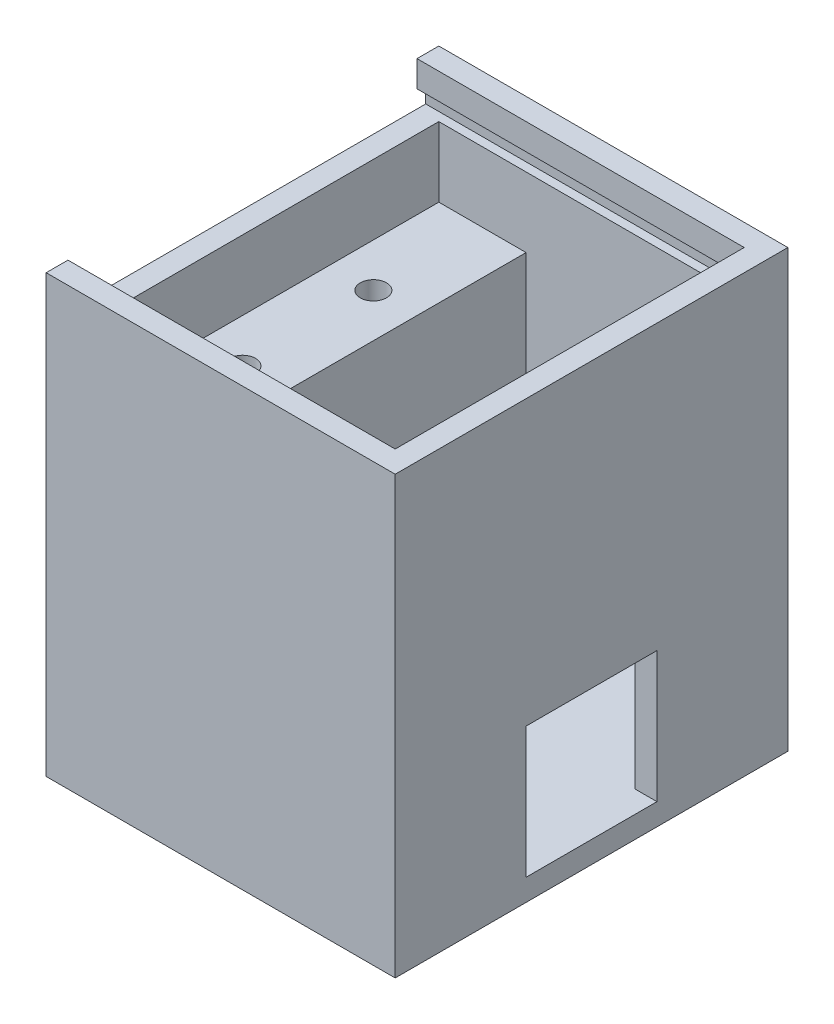
from build123d import *

# Parameters (mm, degrees)
SKETCH1_W           = 40
SKETCH1_H           = 45
BOSS_EXTRUDE1_DEPTH = 50
SHELL1_T            = -2.5
SKETCH3_W           = 40
SKETCH3_H           = 34.5
BOSS_EXTRUDE2_DEPTH = 10
SKETCH11_W          = 40
SKETCH11_H          = 5
CUT_EXTRUDE2_DEPTH  = 2.5
SKETCH12_W          = 37.5
SKETCH12_H          = 2
CUT_EXTRUDE3_DEPTH  = 1
SKETCH13_W          = 37.5
SKETCH13_H          = 2
CUT_EXTRUDE4_DEPTH  = 1
SKETCH15_R          = 1.5
CUT_EXTRUDE7_DEPTH  = 37
SKETCH16_R          = 1.5
CUT_EXTRUDE8_DEPTH  = 37
SKETCH17_R          = 3
CUT_EXTRUDE9_DEPTH  = 5
SKETCH19_W          = 15
SKETCH19_H          = 15
CUT_EXTRUDE10_DEPTH = 2.5


with BuildPart() as part:
    # Sketch1 → Boss-Extrude1 (new body)
    with BuildSketch(Plane(origin=(0, 0, 0), x_dir=(1, 0, 0), z_dir=(0, 1, 0))):
        with Locations((-14.888700463, -8.449653636)):
            Rectangle(SKETCH1_W, SKETCH1_H)
    extrude(amount=BOSS_EXTRUDE1_DEPTH)

    # Shell1
    shell1_openings = [part.faces().sort_by_distance(p)[0] for p in [
        (-14.888700463, 50, 8.449653636),
    ]]
    offset(amount=SHELL1_T, openings=shell1_openings, kind=Kind.INTERSECTION)

    # Sketch3 → Boss-Extrude2 (add)
    with BuildSketch(Plane(origin=(-32.388700463, 0, 0), x_dir=(0, 0, -1), z_dir=(1, 0, 0))):
        with Locations((-8.449653636, 19.75)):
            Rectangle(SKETCH3_W, SKETCH3_H)
    extrude(amount=BOSS_EXTRUDE2_DEPTH)

    # Sketch11 → Cut-Extrude2 (cut)
    with BuildSketch(Plane(origin=(-32.388700463, 0, 0), x_dir=(0, 0, -1), z_dir=(1, 0, 0))):
        with Locations((-8.449653636, 47.5)):
            Rectangle(SKETCH11_W, SKETCH11_H)
    extrude(amount=-CUT_EXTRUDE2_DEPTH, mode=Mode.SUBTRACT)

    # Sketch12 → Cut-Extrude3 (cut)
    with BuildSketch(Plane.XY.offset(-11.550346364)):
        with Locations((-16.138700463, 46)):
            Rectangle(SKETCH12_W, SKETCH12_H)
    extrude(amount=-CUT_EXTRUDE3_DEPTH, mode=Mode.SUBTRACT)

    # Sketch13 → Cut-Extrude4 (cut)
    with BuildSketch(Plane(origin=(0, 0, 28.449653636), x_dir=(-1, 0, 0), z_dir=(0, 0, -1))):
        with Locations((16.138700463, 46)):
            Rectangle(SKETCH13_W, SKETCH13_H)
    extrude(amount=-CUT_EXTRUDE4_DEPTH, mode=Mode.SUBTRACT)

    # Sketch15 → Cut-Extrude7 (cut)
    with BuildSketch(Plane(origin=(0, 37, 0), x_dir=(1, 0, 0), z_dir=(0, 1, 0))):
        with Locations(Location((-27.388700463, -15.949653636, 0), (0, 0, 270))):
            Circle(SKETCH15_R)
    extrude(amount=-CUT_EXTRUDE7_DEPTH, mode=Mode.SUBTRACT)

    # Sketch16 → Cut-Extrude8 (cut)
    with BuildSketch(Plane(origin=(0, 37, 0), x_dir=(1, 0, 0), z_dir=(0, 1, 0))):
        with Locations(Location((-27.388700463, -0.949653636, 0), (0, 0, 270))):
            Circle(SKETCH16_R)
    extrude(amount=-CUT_EXTRUDE8_DEPTH, mode=Mode.SUBTRACT)

    # Sketch17 → Cut-Extrude9 (cut)
    with BuildSketch(Plane.XZ):
        with Locations(Location((-27.388700463, 15.949653636, 0), (0, 0, 270))):
            Circle(SKETCH17_R)
        with Locations(Location((-27.388700463, 0.949653636, 0), (0, 0, 270))):
            Circle(SKETCH17_R)
    extrude(amount=-CUT_EXTRUDE9_DEPTH, mode=Mode.SUBTRACT)

    # Sketch19 → Cut-Extrude10 (cut)
    with BuildSketch(Plane.ZY.offset(-2.611299537)):
        with Locations((8.449653636, 10)):
            Rectangle(SKETCH19_W, SKETCH19_H)
    extrude(amount=-CUT_EXTRUDE10_DEPTH, mode=Mode.SUBTRACT)


solid = part.part
